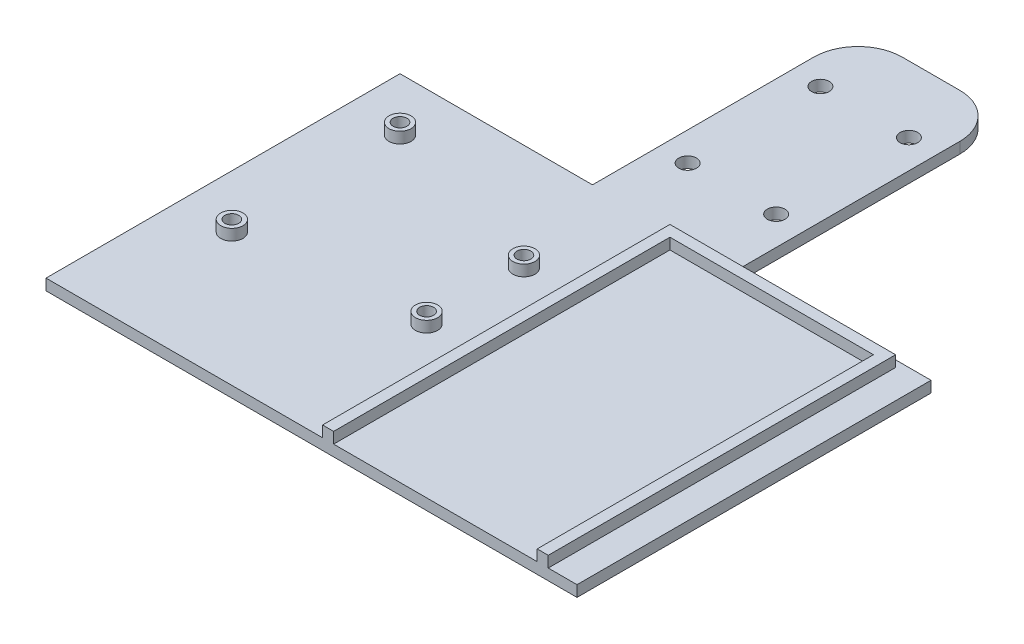
from build123d import *

# Parameters (mm, degrees)
SKETCH1_W           = 41.91
SKETCH1_H           = 76.2
SKETCH1_R           = 2.54
BOSS_EXTRUDE1_DEPTH = 3.175
SKETCH2_W           = 152.4
SKETCH2_H           = 101.6
BOSS_EXTRUDE2_DEPTH = 3.175
SKETCH3_R           = 2
CUT_EXTRUDE1_DEPTH  = 160.162214816
BOSS_EXTRUDE3_DEPTH = 3.175
BOSS_EXTRUDE4_START = 3.175
SKETCH5_R           = 3.175
SKETCH5_R_2         = 2
BOSS_EXTRUDE4_DEPTH = 3.175
FILLET1_R           = 12.7


with BuildPart() as part:
    # Sketch1 → Boss-Extrude1 (new body)
    with BuildSketch(Plane(origin=(0, 0, 0), x_dir=(1, 0, 0), z_dir=(0, 1, 0))):
        Rectangle(SKETCH1_W, SKETCH1_H)
        with Locations(Location((-12.7, 19.05, 0), (0, 0, 270))):
            Circle(SKETCH1_R, mode=Mode.SUBTRACT)
        with Locations(Location((-12.7, -19.05, 0), (0, 0, 270))):
            Circle(SKETCH1_R, mode=Mode.SUBTRACT)
        with Locations(Location((12.7, -19.05, 0), (0, 0, 270))):
            Circle(SKETCH1_R, mode=Mode.SUBTRACT)
        with Locations(Location((12.7, 19.05, 0), (0, 0, 270))):
            Circle(SKETCH1_R, mode=Mode.SUBTRACT)
    extrude(amount=BOSS_EXTRUDE1_DEPTH)

    # Sketch2 → Boss-Extrude2 (add)
    with BuildSketch(Plane(origin=(0, 3.175, 0), x_dir=(1, 0, 0), z_dir=(0, 1, 0))):
        with Locations((0, -88.9)):
            Rectangle(SKETCH2_W, SKETCH2_H)
    extrude(amount=-BOSS_EXTRUDE2_DEPTH)

    # Sketch3 → Cut-Extrude1 (cut, through all)
    with BuildSketch(Plane(origin=(0, 3.175, 0), x_dir=(1, 0, 0), z_dir=(0, 1, 0))):
        with Locations(Location((-60.96, -53.34, 0), (0, 0, 270))):
            Circle(SKETCH3_R)
        with Locations(Location((-60.96, -101.6, 0), (0, 0, 270))):
            Circle(SKETCH3_R)
        with Locations(Location((-10.16, -68.58, 0), (0, 0, 270))):
            Circle(SKETCH3_R)
        with Locations(Location((-10.16, -96.52, 0), (0, 0, 270))):
            Circle(SKETCH3_R)
    extrude(amount=-CUT_EXTRUDE1_DEPTH, mode=Mode.SUBTRACT)

    # Sketch4 → Boss-Extrude3 (add)
    with BuildSketch(Plane(origin=(0, 3.175, 0), x_dir=(1, 0, 0), z_dir=(0, 1, 0))):
        Polygon((64.77, -43.18), (64.77, -120.65), (64.77, -139.7), (67.945, -139.7), (67.945, -120.65), (67.945, -40.005), (3.175, -40.005), (3.175, -120.65), (3.175, -139.7), (6.35, -139.7), (6.35, -120.65), (6.35, -43.18), align=None)
    extrude(amount=BOSS_EXTRUDE3_DEPTH)

    # Sketch5 → Boss-Extrude4 (add)
    # profile 1 of 4: a face of its own
    with BuildSketch(Plane(origin=(0, 3.175, 0), x_dir=(1, 0, 0), z_dir=(0, 1, 0)).offset(BOSS_EXTRUDE4_START)):
        with Locations(Location((-60.96, -53.34, 0), (0, 0, 90))):
            Circle(SKETCH5_R)
        with Locations(Location((-60.96, -53.34, 0), (0, 0, 270))):
            Circle(SKETCH5_R_2, mode=Mode.SUBTRACT)
    # profile 2 of 4: a face of its own
    with BuildSketch(Plane(origin=(0, 3.175, 0), x_dir=(1, 0, 0), z_dir=(0, 1, 0)).offset(BOSS_EXTRUDE4_START)):
        with Locations(Location((-60.96, -101.6, 0), (0, 0, 90))):
            Circle(SKETCH5_R)
        with Locations(Location((-60.96, -101.6, 0), (0, 0, 270))):
            Circle(SKETCH5_R_2, mode=Mode.SUBTRACT)
    # profile 3 of 4: a face of its own
    with BuildSketch(Plane(origin=(0, 3.175, 0), x_dir=(1, 0, 0), z_dir=(0, 1, 0)).offset(BOSS_EXTRUDE4_START)):
        with Locations(Location((-10.16, -96.52, 0), (0, 0, 90))):
            Circle(SKETCH5_R)
        with Locations(Location((-10.16, -96.52, 0), (0, 0, 270))):
            Circle(SKETCH5_R_2, mode=Mode.SUBTRACT)
    # profile 4 of 4: a face of its own
    with BuildSketch(Plane(origin=(0, 3.175, 0), x_dir=(1, 0, 0), z_dir=(0, 1, 0)).offset(BOSS_EXTRUDE4_START)):
        with Locations(Location((-10.16, -68.58, 0), (0, 0, 90))):
            Circle(SKETCH5_R)
        with Locations(Location((-10.16, -68.58, 0), (0, 0, 270))):
            Circle(SKETCH5_R_2, mode=Mode.SUBTRACT)
    extrude(amount=-BOSS_EXTRUDE4_DEPTH)

    # Fillet1
    fillet1_edges = [part.edges().sort_by_distance(p)[0] for p in [
        (-20.955, 1.5875, -38.1),
        (20.955, 1.5875, -38.1),
    ]]
    fillet(fillet1_edges, radius=FILLET1_R)


solid = part.part
